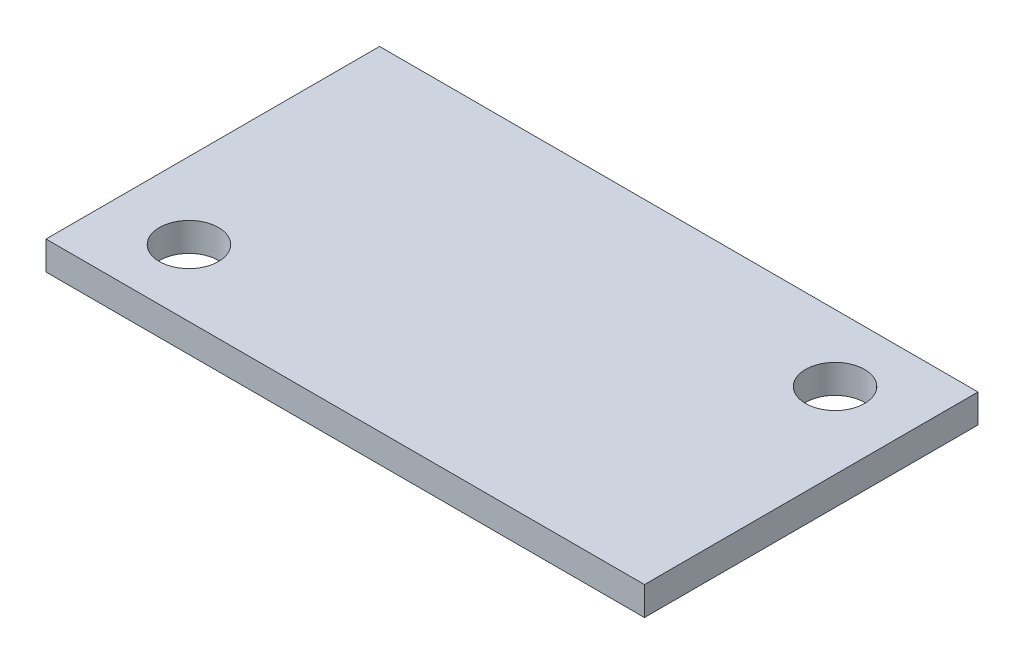
from build123d import *

# Parameters (mm, degrees)
SZKIC1_W                    = 31.4
SZKIC1_H                    = 17.5
DODANIE_WYCI_GNI_CIE1_DEPTH = 1.5
SZKIC2_R                    = 1.55
WYTNIJ_WYCI_GNI_CIE1_DEPTH  = 1.5
SZKIC3_W                    = 2.9
SZKIC3_H                    = 1.6
DODANIE_WYCI_GNI_CIE2_DEPTH = 1.8
SZKIC4_W                    = 3
SZKIC4_H                    = 7.5
DODANIE_WYCI_GNI_CIE3_DEPTH = 2.5
SZKIC6_W                    = 1
SZKIC6_H                    = 1
DODANIE_WYCI_GNI_CIE5_DEPTH = 5.8
SZYK_LINIOWY3_COUNT         = 3
SZYK_LINIOWY3_PITCH         = 2.5


with BuildPart() as part:
    # Szkic1 → Dodanie-wyciągnięcie1 (new body)
    with BuildSketch(Plane.XZ.offset(21.816434763)):
        with Locations((347.160462116, -460.278787137)):
            Rectangle(SZKIC1_W, SZKIC1_H)
    extrude(amount=DODANIE_WYCI_GNI_CIE1_DEPTH)

    # Szkic2 → Wytnij-wyciągnięcie1 (cut)
    with BuildSketch(Plane.XZ.offset(23.316434763)):
        with Locations((358.860462116, -465.528787137)):
            Circle(SZKIC2_R)
        with Locations((335.460462116, -455.028787137)):
            Circle(SZKIC2_R)
    extrude(amount=-WYTNIJ_WYCI_GNI_CIE1_DEPTH, mode=Mode.SUBTRACT)

    # Szkic3 → Dodanie-wyciągnięcie2 (add)
    with BuildSketch(Plane.XZ.offset(23.316434763)):
        with Locations((348.660462116, -457.028787137)):
            Rectangle(SZKIC3_W, SZKIC3_H)
    extrude(amount=DODANIE_WYCI_GNI_CIE2_DEPTH)

    # Szkic4 → Dodanie-wyciągnięcie3 (add)
    with BuildSketch(Plane.XZ.offset(23.316434763)):
        with Locations((338.960462116, -463.528787137)):
            Rectangle(SZKIC4_W, SZKIC4_H)
    extrude(amount=DODANIE_WYCI_GNI_CIE3_DEPTH)

    # Szkic6 → Dodanie-wyciągnięcie5 (add)
    with BuildSketch(Plane.ZY.offset(-337.460462116)):
        with Locations((-461.028787137, -24.566434763)):
            Rectangle(SZKIC6_W, SZKIC6_H)
    dodanie_wyci_gni_cie5 = extrude(amount=DODANIE_WYCI_GNI_CIE5_DEPTH)

    # Szyk liniowy3: Dodanie-wyciągnięcie5 ×3
    with Locations(*[(0, 0, -i * SZYK_LINIOWY3_PITCH) for i in range(1, SZYK_LINIOWY3_COUNT)]):
        add(dodanie_wyci_gni_cie5)


solid = part.part
